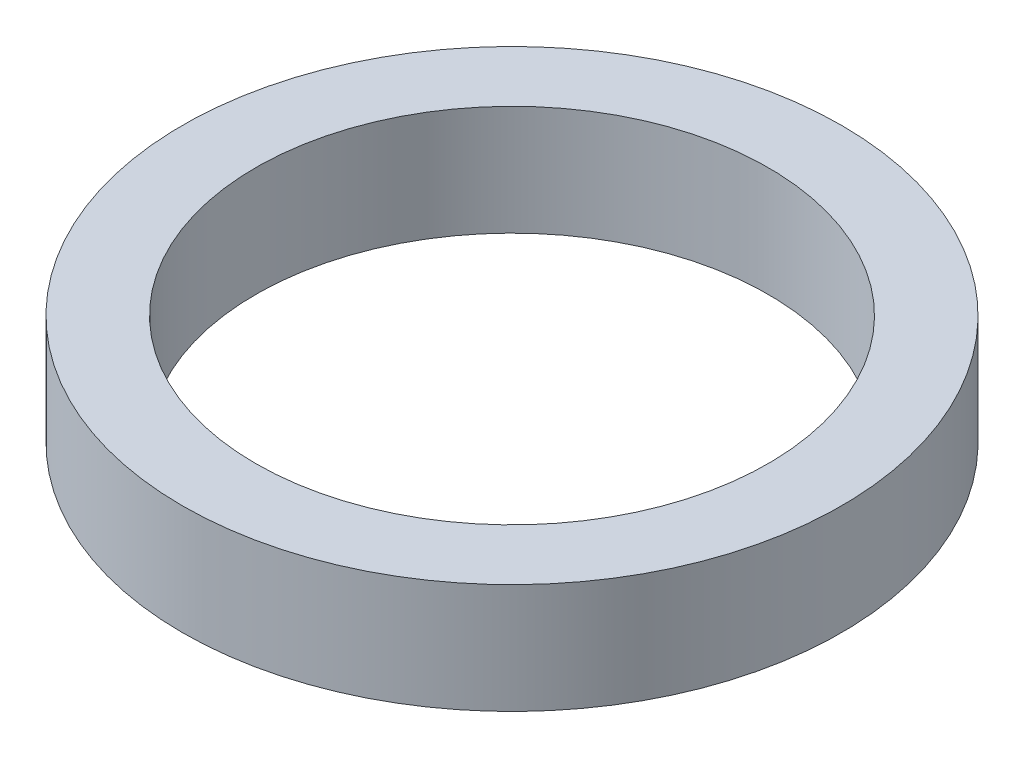
from build123d import *

# Parameters (mm, degrees)
SKETCH1_R           = 4.5
SKETCH1_R_2         = 3.5
BOSS_EXTRUDE1_DEPTH = 1.5


with BuildPart() as part:
    # Sketch1 → Boss-Extrude1 (new body)
    with BuildSketch(Plane(origin=(0, 0, 0), x_dir=(1, 0, 0), z_dir=(0, 1, 0))):
        with Locations(Location((0, 0, 0), (0, 0, 270))):
            Circle(SKETCH1_R)
        with Locations(Location((0, 0, 0), (0, 0, 270))):
            Circle(SKETCH1_R_2, mode=Mode.SUBTRACT)
    extrude(amount=BOSS_EXTRUDE1_DEPTH)


solid = part.part
